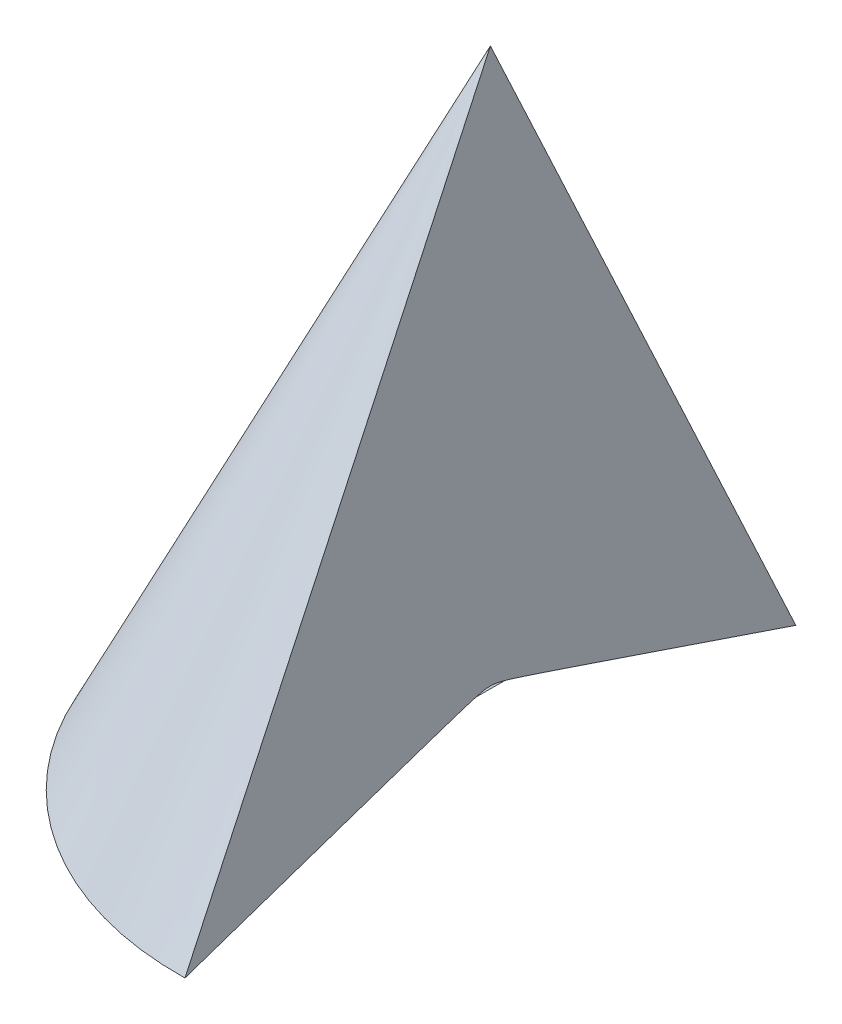
from build123d import *

# Parameters (mm, degrees)
CUT_EXTRUDE2_DEPTH      = 128.750222463
CUT_EXTRUDE2_DEPTH_BACK = 128.750222463


with BuildPart() as part:
    # Sketch1 → Revolve2 (revolve)
    with BuildSketch(Plane.XY, mode=Mode.PRIVATE) as revolve2_sk:
        Polygon((1.83448668, 100.365327204), (-56.055714348, -17.878019084), (0, 0), align=None)
    revolve(revolve2_sk.sketch.rotate(Axis((0, 0, 0), (0.01827503947467049, 0.9998329975211857, 0)), 180), axis=Axis((0, 0, 0), (0.01827503947467049, 0.9998329975211857, 0)))

    # Sketch4 → Cut-Extrude2 (cut, two sides: drawn at the far end of the back side and taken through both)
    with BuildSketch(Plane.XY.offset(-CUT_EXTRUDE2_DEPTH_BACK)):
        Polygon((1.83448668, 100.365327204), (1.83448668, -33.113134912), (93.280770059, -23.608140786), (67.90487647, 121.287495173), (19.689198564, 148.669077991), (11.914226706, 134.978286582), align=None)
    extrude(amount=CUT_EXTRUDE2_DEPTH + CUT_EXTRUDE2_DEPTH_BACK, mode=Mode.SUBTRACT)


solid = part.part
